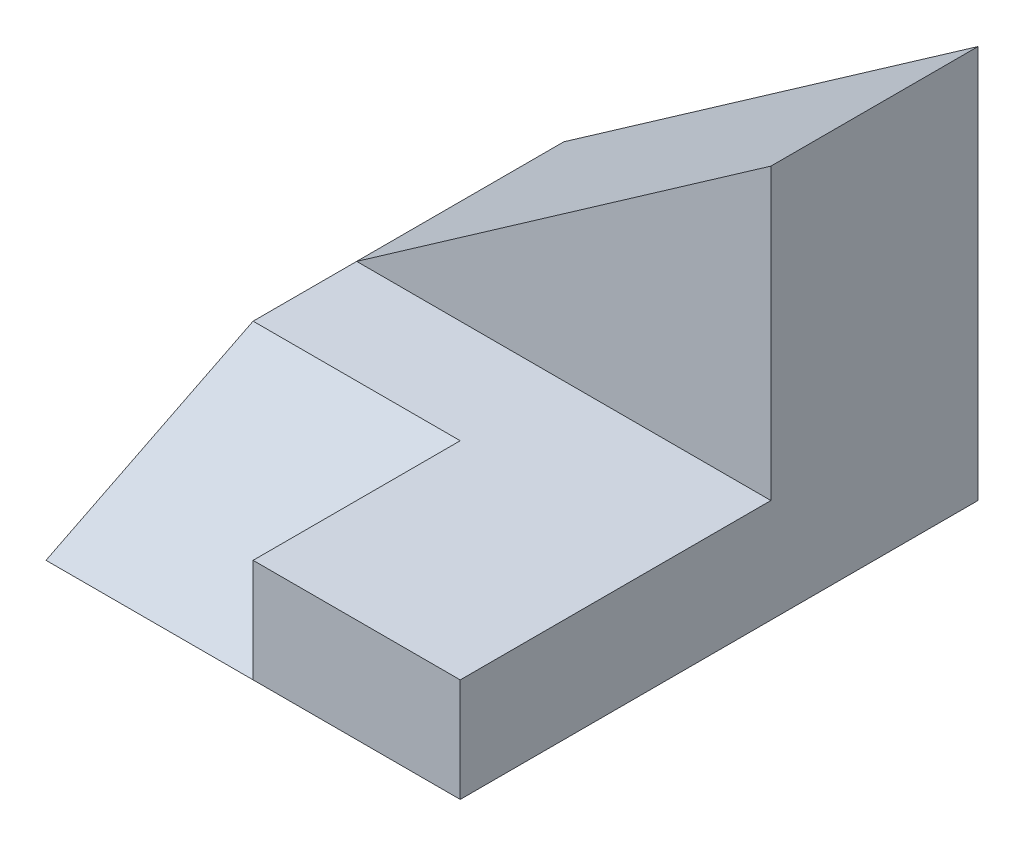
from build123d import *

# Parameters (mm, degrees)
BOSS_EXTRUDE1_DEPTH = 20
SKETCH3_W           = 40
SKETCH3_H           = 10
BOSS_EXTRUDE2_DEPTH = 30
CUT_EXTRUDE2_DEPTH  = 20


with BuildPart() as part:
    # Sketch1 → Boss-Extrude1 (new body)
    with BuildSketch(Plane.XY):
        Polygon((0, 10), (40, 37.966903073), (40, 10), (40, 0), (0, 0), align=None)
    extrude(amount=BOSS_EXTRUDE1_DEPTH)

    # Sketch3 → Boss-Extrude2 (add)
    with BuildSketch(Plane.XY.offset(20)):
        with Locations((20, 5)):
            Rectangle(SKETCH3_W, SKETCH3_H)
    extrude(amount=BOSS_EXTRUDE2_DEPTH)

    # Sketch4 → Cut-Extrude2 (cut)
    with BuildSketch(Plane.ZY):
        Polygon((50, 10), (30, 10), (50, 0), align=None)
    extrude(amount=-CUT_EXTRUDE2_DEPTH, mode=Mode.SUBTRACT)


solid = part.part
